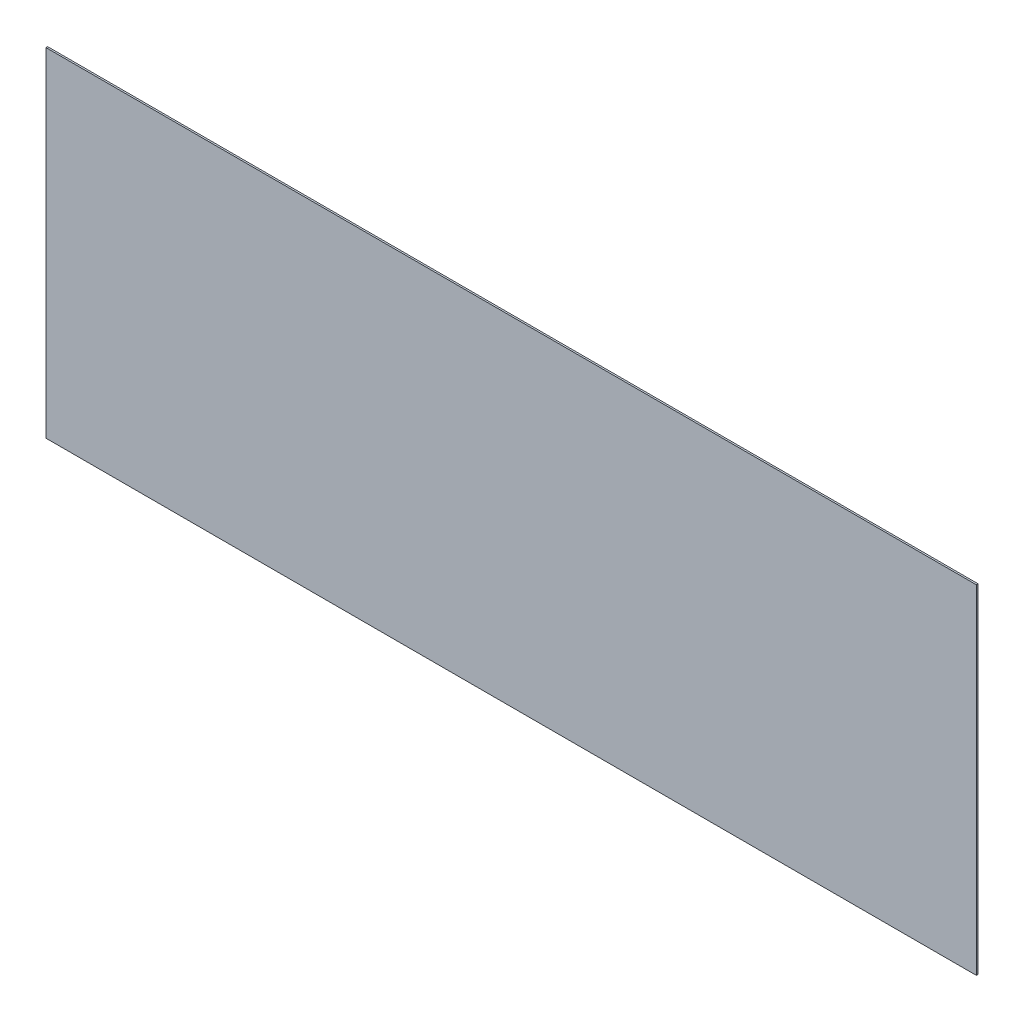
from build123d import *

# Parameters (mm, degrees)
SKETCH1_W           = 5500
SKETCH1_H           = 2000
BOSS_EXTRUDE1_DEPTH = 5


with BuildPart() as part:
    # Sketch1 → Boss-Extrude1 (new, symmetric)
    with BuildSketch(Plane.XY):
        Rectangle(SKETCH1_W, SKETCH1_H)
    extrude(amount=BOSS_EXTRUDE1_DEPTH, both=True)


solid = part.part
